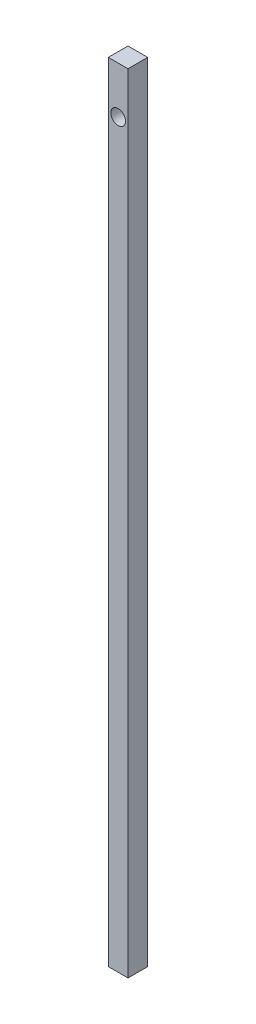
from build123d import *

# Parameters (mm, degrees)
SKETCH1_W           = 50.8
SKETCH1_H           = 50.8
BOSS_EXTRUDE1_DEPTH = 2032
SKETCH2_R           = 19.05
CUT_EXTRUDE1_DEPTH  = 2033.793595031


with BuildPart() as part:
    # Sketch1 → Boss-Extrude1 (new body)
    with BuildSketch(Plane(origin=(0, 0, 0), x_dir=(1, 0, 0), z_dir=(0, 1, 0))):
        Rectangle(SKETCH1_W, SKETCH1_H)
    extrude(amount=BOSS_EXTRUDE1_DEPTH)

    # Sketch2 → Cut-Extrude1 (cut, through all)
    with BuildSketch(Plane.XY.offset(25.4)):
        with Locations((0, 1911.35)):
            Circle(SKETCH2_R)
    extrude(amount=-CUT_EXTRUDE1_DEPTH, mode=Mode.SUBTRACT)


solid = part.part
